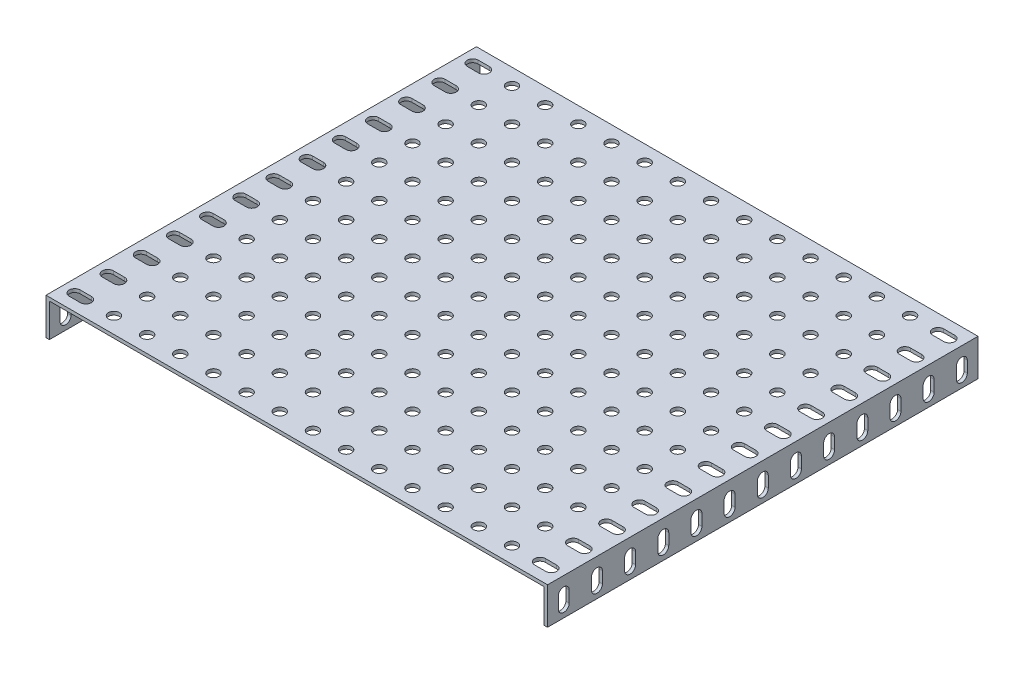
from build123d import *

# Parameters (mm, degrees)
SKETCH1_W           = 192.94
SKETCH1_H           = 165.58
SKETCH1_R           = 2.11
BOSS_EXTRUDE1_DEPTH = 1.3
SKETCH3_W           = 165.58
SKETCH3_H           = 14.16
BOSS_EXTRUDE2_DEPTH = 1.3


with BuildPart() as part:
    # Sketch1 → Boss-Extrude1 (new body)
    with BuildSketch(Plane(origin=(0, 0, 0), x_dir=(1, 0, 0), z_dir=(0, 1, 0))):
        Rectangle(SKETCH1_W, SKETCH1_H)
        with Locations(Location((-76.56, -76.56, 0), (0, 0, 270))):
            Circle(SKETCH1_R, mode=Mode.SUBTRACT)
        with Locations(Location((-63.8, -76.56, 0), (0, 0, 270))):
            Circle(SKETCH1_R, mode=Mode.SUBTRACT)
        with Locations(Location((-51.04, -76.56, 0), (0, 0, 270))):
            Circle(SKETCH1_R, mode=Mode.SUBTRACT)
        with Locations(Location((-38.28, -76.56, 0), (0, 0, 270))):
            Circle(SKETCH1_R, mode=Mode.SUBTRACT)
        with Locations(Location((-25.52, -76.56, 0), (0, 0, 270))):
            Circle(SKETCH1_R, mode=Mode.SUBTRACT)
        with Locations(Location((-12.76, -76.56, 0), (0, 0, 270))):
            Circle(SKETCH1_R, mode=Mode.SUBTRACT)
        with Locations(Location((0, -76.56, 0), (0, 0, 270))):
            Circle(SKETCH1_R, mode=Mode.SUBTRACT)
        with Locations(Location((12.76, -76.56, 0), (0, 0, 270))):
            Circle(SKETCH1_R, mode=Mode.SUBTRACT)
        with Locations(Location((25.52, -76.56, 0), (0, 0, 270))):
            Circle(SKETCH1_R, mode=Mode.SUBTRACT)
        with Locations(Location((38.28, -76.56, 0), (0, 0, 270))):
            Circle(SKETCH1_R, mode=Mode.SUBTRACT)
        with Locations(Location((51.04, -76.56, 0), (0, 0, 270))):
            Circle(SKETCH1_R, mode=Mode.SUBTRACT)
        with Locations(Location((63.8, -76.56, 0), (0, 0, 270))):
            Circle(SKETCH1_R, mode=Mode.SUBTRACT)
        with Locations(Location((76.56, -76.56, 0), (0, 0, 270))):
            Circle(SKETCH1_R, mode=Mode.SUBTRACT)
        with Locations(Location((-63.8, -63.8, 0), (0, 0, 270))):
            Circle(SKETCH1_R, mode=Mode.SUBTRACT)
        with Locations(Location((-51.04, -63.8, 0), (0, 0, 270))):
            Circle(SKETCH1_R, mode=Mode.SUBTRACT)
        with Locations(Location((-38.28, -63.8, 0), (0, 0, 270))):
            Circle(SKETCH1_R, mode=Mode.SUBTRACT)
        with Locations(Location((-25.52, -63.8, 0), (0, 0, 270))):
            Circle(SKETCH1_R, mode=Mode.SUBTRACT)
        with Locations(Location((-12.76, -63.8, 0), (0, 0, 270))):
            Circle(SKETCH1_R, mode=Mode.SUBTRACT)
        with Locations(Location((0, -63.8, 0), (0, 0, 270))):
            Circle(SKETCH1_R, mode=Mode.SUBTRACT)
        with Locations(Location((12.76, -63.8, 0), (0, 0, 270))):
            Circle(SKETCH1_R, mode=Mode.SUBTRACT)
        with Locations(Location((25.52, -63.8, 0), (0, 0, 270))):
            Circle(SKETCH1_R, mode=Mode.SUBTRACT)
        with Locations(Location((38.28, -63.8, 0), (0, 0, 270))):
            Circle(SKETCH1_R, mode=Mode.SUBTRACT)
        with Locations(Location((51.04, -63.8, 0), (0, 0, 270))):
            Circle(SKETCH1_R, mode=Mode.SUBTRACT)
        with Locations(Location((63.8, -63.8, 0), (0, 0, 270))):
            Circle(SKETCH1_R, mode=Mode.SUBTRACT)
        with Locations(Location((76.56, -63.8, 0), (0, 0, 270))):
            Circle(SKETCH1_R, mode=Mode.SUBTRACT)
        with Locations(Location((-63.8, -51.04, 0), (0, 0, 270))):
            Circle(SKETCH1_R, mode=Mode.SUBTRACT)
        with Locations(Location((-51.04, -51.04, 0), (0, 0, 270))):
            Circle(SKETCH1_R, mode=Mode.SUBTRACT)
        with Locations(Location((-38.28, -51.04, 0), (0, 0, 270))):
            Circle(SKETCH1_R, mode=Mode.SUBTRACT)
        with Locations(Location((-25.52, -51.04, 0), (0, 0, 270))):
            Circle(SKETCH1_R, mode=Mode.SUBTRACT)
        with Locations(Location((-12.76, -51.04, 0), (0, 0, 270))):
            Circle(SKETCH1_R, mode=Mode.SUBTRACT)
        with Locations(Location((0, -51.04, 0), (0, 0, 270))):
            Circle(SKETCH1_R, mode=Mode.SUBTRACT)
        with Locations(Location((12.76, -51.04, 0), (0, 0, 270))):
            Circle(SKETCH1_R, mode=Mode.SUBTRACT)
        with Locations(Location((25.52, -51.04, 0), (0, 0, 270))):
            Circle(SKETCH1_R, mode=Mode.SUBTRACT)
        with Locations(Location((38.28, -51.04, 0), (0, 0, 270))):
            Circle(SKETCH1_R, mode=Mode.SUBTRACT)
        with Locations(Location((51.04, -51.04, 0), (0, 0, 270))):
            Circle(SKETCH1_R, mode=Mode.SUBTRACT)
        with Locations(Location((63.8, -51.04, 0), (0, 0, 270))):
            Circle(SKETCH1_R, mode=Mode.SUBTRACT)
        with Locations(Location((76.56, -51.04, 0), (0, 0, 270))):
            Circle(SKETCH1_R, mode=Mode.SUBTRACT)
        with Locations(Location((-63.8, -38.28, 0), (0, 0, 270))):
            Circle(SKETCH1_R, mode=Mode.SUBTRACT)
        with Locations(Location((-51.04, -38.28, 0), (0, 0, 270))):
            Circle(SKETCH1_R, mode=Mode.SUBTRACT)
        with Locations(Location((-38.28, -38.28, 0), (0, 0, 270))):
            Circle(SKETCH1_R, mode=Mode.SUBTRACT)
        with Locations(Location((-25.52, -38.28, 0), (0, 0, 270))):
            Circle(SKETCH1_R, mode=Mode.SUBTRACT)
        with Locations(Location((-12.76, -38.28, 0), (0, 0, 270))):
            Circle(SKETCH1_R, mode=Mode.SUBTRACT)
        with Locations(Location((0, -38.28, 0), (0, 0, 270))):
            Circle(SKETCH1_R, mode=Mode.SUBTRACT)
        with Locations(Location((12.76, -38.28, 0), (0, 0, 270))):
            Circle(SKETCH1_R, mode=Mode.SUBTRACT)
        with Locations(Location((25.52, -38.28, 0), (0, 0, 270))):
            Circle(SKETCH1_R, mode=Mode.SUBTRACT)
        with Locations(Location((38.28, -38.28, 0), (0, 0, 270))):
            Circle(SKETCH1_R, mode=Mode.SUBTRACT)
        with Locations(Location((51.04, -38.28, 0), (0, 0, 270))):
            Circle(SKETCH1_R, mode=Mode.SUBTRACT)
        with Locations(Location((63.8, -38.28, 0), (0, 0, 270))):
            Circle(SKETCH1_R, mode=Mode.SUBTRACT)
        with Locations(Location((76.56, -38.28, 0), (0, 0, 270))):
            Circle(SKETCH1_R, mode=Mode.SUBTRACT)
        with Locations(Location((-63.8, -25.52, 0), (0, 0, 270))):
            Circle(SKETCH1_R, mode=Mode.SUBTRACT)
        with Locations(Location((-51.04, -25.52, 0), (0, 0, 270))):
            Circle(SKETCH1_R, mode=Mode.SUBTRACT)
        with Locations(Location((-38.28, -25.52, 0), (0, 0, 270))):
            Circle(SKETCH1_R, mode=Mode.SUBTRACT)
        with Locations(Location((-25.52, -25.52, 0), (0, 0, 270))):
            Circle(SKETCH1_R, mode=Mode.SUBTRACT)
        with Locations(Location((-12.76, -25.52, 0), (0, 0, 270))):
            Circle(SKETCH1_R, mode=Mode.SUBTRACT)
        with Locations(Location((0, -25.52, 0), (0, 0, 270))):
            Circle(SKETCH1_R, mode=Mode.SUBTRACT)
        with Locations(Location((12.76, -25.52, 0), (0, 0, 270))):
            Circle(SKETCH1_R, mode=Mode.SUBTRACT)
        with Locations(Location((25.52, -25.52, 0), (0, 0, 270))):
            Circle(SKETCH1_R, mode=Mode.SUBTRACT)
        with Locations(Location((38.28, -25.52, 0), (0, 0, 270))):
            Circle(SKETCH1_R, mode=Mode.SUBTRACT)
        with Locations(Location((51.04, -25.52, 0), (0, 0, 270))):
            Circle(SKETCH1_R, mode=Mode.SUBTRACT)
        with Locations(Location((63.8, -25.52, 0), (0, 0, 270))):
            Circle(SKETCH1_R, mode=Mode.SUBTRACT)
        with Locations(Location((76.56, -25.52, 0), (0, 0, 270))):
            Circle(SKETCH1_R, mode=Mode.SUBTRACT)
        with Locations(Location((-63.8, -12.76, 0), (0, 0, 270))):
            Circle(SKETCH1_R, mode=Mode.SUBTRACT)
        with Locations(Location((-51.04, -12.76, 0), (0, 0, 270))):
            Circle(SKETCH1_R, mode=Mode.SUBTRACT)
        with Locations(Location((-38.28, -12.76, 0), (0, 0, 270))):
            Circle(SKETCH1_R, mode=Mode.SUBTRACT)
        with Locations(Location((-25.52, -12.76, 0), (0, 0, 270))):
            Circle(SKETCH1_R, mode=Mode.SUBTRACT)
        with Locations(Location((-12.76, -12.76, 0), (0, 0, 270))):
            Circle(SKETCH1_R, mode=Mode.SUBTRACT)
        with Locations(Location((0, -12.76, 0), (0, 0, 270))):
            Circle(SKETCH1_R, mode=Mode.SUBTRACT)
        with Locations(Location((12.76, -12.76, 0), (0, 0, 270))):
            Circle(SKETCH1_R, mode=Mode.SUBTRACT)
        with Locations(Location((25.52, -12.76, 0), (0, 0, 270))):
            Circle(SKETCH1_R, mode=Mode.SUBTRACT)
        with Locations(Location((38.28, -12.76, 0), (0, 0, 270))):
            Circle(SKETCH1_R, mode=Mode.SUBTRACT)
        with Locations(Location((51.04, -12.76, 0), (0, 0, 270))):
            Circle(SKETCH1_R, mode=Mode.SUBTRACT)
        with Locations(Location((63.8, -12.76, 0), (0, 0, 270))):
            Circle(SKETCH1_R, mode=Mode.SUBTRACT)
        with Locations(Location((76.56, -12.76, 0), (0, 0, 270))):
            Circle(SKETCH1_R, mode=Mode.SUBTRACT)
        with Locations(Location((-63.8, 0, 0), (0, 0, 270))):
            Circle(SKETCH1_R, mode=Mode.SUBTRACT)
        with Locations(Location((-51.04, 0, 0), (0, 0, 270))):
            Circle(SKETCH1_R, mode=Mode.SUBTRACT)
        with Locations(Location((-38.28, 0, 0), (0, 0, 270))):
            Circle(SKETCH1_R, mode=Mode.SUBTRACT)
        with Locations(Location((-25.52, 0, 0), (0, 0, 270))):
            Circle(SKETCH1_R, mode=Mode.SUBTRACT)
        with Locations(Location((-12.76, 0, 0), (0, 0, 270))):
            Circle(SKETCH1_R, mode=Mode.SUBTRACT)
        with Locations(Location((0, 0, 0), (0, 0, 270))):
            Circle(SKETCH1_R, mode=Mode.SUBTRACT)
        with Locations(Location((12.76, 0, 0), (0, 0, 270))):
            Circle(SKETCH1_R, mode=Mode.SUBTRACT)
        with Locations(Location((25.52, 0, 0), (0, 0, 270))):
            Circle(SKETCH1_R, mode=Mode.SUBTRACT)
        with Locations(Location((38.28, 0, 0), (0, 0, 270))):
            Circle(SKETCH1_R, mode=Mode.SUBTRACT)
        with Locations(Location((51.04, 0, 0), (0, 0, 270))):
            Circle(SKETCH1_R, mode=Mode.SUBTRACT)
        with Locations(Location((63.8, 0, 0), (0, 0, 270))):
            Circle(SKETCH1_R, mode=Mode.SUBTRACT)
        with Locations(Location((76.56, 0, 0), (0, 0, 270))):
            Circle(SKETCH1_R, mode=Mode.SUBTRACT)
        with Locations(Location((-63.8, 12.76, 0), (0, 0, 270))):
            Circle(SKETCH1_R, mode=Mode.SUBTRACT)
        with Locations(Location((-51.04, 12.76, 0), (0, 0, 270))):
            Circle(SKETCH1_R, mode=Mode.SUBTRACT)
        with Locations(Location((-38.28, 12.76, 0), (0, 0, 270))):
            Circle(SKETCH1_R, mode=Mode.SUBTRACT)
        with Locations(Location((-25.52, 12.76, 0), (0, 0, 270))):
            Circle(SKETCH1_R, mode=Mode.SUBTRACT)
        with Locations(Location((-12.76, 12.76, 0), (0, 0, 270))):
            Circle(SKETCH1_R, mode=Mode.SUBTRACT)
        with Locations(Location((0, 12.76, 0), (0, 0, 270))):
            Circle(SKETCH1_R, mode=Mode.SUBTRACT)
        with Locations(Location((12.76, 12.76, 0), (0, 0, 270))):
            Circle(SKETCH1_R, mode=Mode.SUBTRACT)
        with Locations(Location((25.52, 12.76, 0), (0, 0, 270))):
            Circle(SKETCH1_R, mode=Mode.SUBTRACT)
        with Locations(Location((38.28, 12.76, 0), (0, 0, 270))):
            Circle(SKETCH1_R, mode=Mode.SUBTRACT)
        with Locations(Location((51.04, 12.76, 0), (0, 0, 270))):
            Circle(SKETCH1_R, mode=Mode.SUBTRACT)
        with Locations(Location((63.8, 12.76, 0), (0, 0, 270))):
            Circle(SKETCH1_R, mode=Mode.SUBTRACT)
        with Locations(Location((76.56, 12.76, 0), (0, 0, 270))):
            Circle(SKETCH1_R, mode=Mode.SUBTRACT)
        with Locations(Location((-63.8, 25.52, 0), (0, 0, 270))):
            Circle(SKETCH1_R, mode=Mode.SUBTRACT)
        with Locations(Location((-51.04, 25.52, 0), (0, 0, 270))):
            Circle(SKETCH1_R, mode=Mode.SUBTRACT)
        with Locations(Location((-38.28, 25.52, 0), (0, 0, 270))):
            Circle(SKETCH1_R, mode=Mode.SUBTRACT)
        with Locations(Location((-25.52, 25.52, 0), (0, 0, 270))):
            Circle(SKETCH1_R, mode=Mode.SUBTRACT)
        with Locations(Location((-12.76, 25.52, 0), (0, 0, 270))):
            Circle(SKETCH1_R, mode=Mode.SUBTRACT)
        with Locations(Location((0, 25.52, 0), (0, 0, 270))):
            Circle(SKETCH1_R, mode=Mode.SUBTRACT)
        with Locations(Location((12.76, 25.52, 0), (0, 0, 270))):
            Circle(SKETCH1_R, mode=Mode.SUBTRACT)
        with Locations(Location((25.52, 25.52, 0), (0, 0, 270))):
            Circle(SKETCH1_R, mode=Mode.SUBTRACT)
        with Locations(Location((38.28, 25.52, 0), (0, 0, 270))):
            Circle(SKETCH1_R, mode=Mode.SUBTRACT)
        with Locations(Location((51.04, 25.52, 0), (0, 0, 270))):
            Circle(SKETCH1_R, mode=Mode.SUBTRACT)
        with Locations(Location((63.8, 25.52, 0), (0, 0, 270))):
            Circle(SKETCH1_R, mode=Mode.SUBTRACT)
        with Locations(Location((76.56, 25.52, 0), (0, 0, 270))):
            Circle(SKETCH1_R, mode=Mode.SUBTRACT)
        with Locations(Location((-63.8, 38.28, 0), (0, 0, 270))):
            Circle(SKETCH1_R, mode=Mode.SUBTRACT)
        with Locations(Location((-51.04, 38.28, 0), (0, 0, 270))):
            Circle(SKETCH1_R, mode=Mode.SUBTRACT)
        with Locations(Location((-38.28, 38.28, 0), (0, 0, 270))):
            Circle(SKETCH1_R, mode=Mode.SUBTRACT)
        with Locations(Location((-25.52, 38.28, 0), (0, 0, 270))):
            Circle(SKETCH1_R, mode=Mode.SUBTRACT)
        with Locations(Location((-12.76, 38.28, 0), (0, 0, 270))):
            Circle(SKETCH1_R, mode=Mode.SUBTRACT)
        with Locations(Location((0, 38.28, 0), (0, 0, 270))):
            Circle(SKETCH1_R, mode=Mode.SUBTRACT)
        with Locations(Location((12.76, 38.28, 0), (0, 0, 270))):
            Circle(SKETCH1_R, mode=Mode.SUBTRACT)
        with Locations(Location((25.52, 38.28, 0), (0, 0, 270))):
            Circle(SKETCH1_R, mode=Mode.SUBTRACT)
        with Locations(Location((38.28, 38.28, 0), (0, 0, 270))):
            Circle(SKETCH1_R, mode=Mode.SUBTRACT)
        with Locations(Location((51.04, 38.28, 0), (0, 0, 270))):
            Circle(SKETCH1_R, mode=Mode.SUBTRACT)
        with Locations(Location((63.8, 38.28, 0), (0, 0, 270))):
            Circle(SKETCH1_R, mode=Mode.SUBTRACT)
        with Locations(Location((76.56, 38.28, 0), (0, 0, 270))):
            Circle(SKETCH1_R, mode=Mode.SUBTRACT)
        with Locations(Location((-63.8, 51.04, 0), (0, 0, 270))):
            Circle(SKETCH1_R, mode=Mode.SUBTRACT)
        with Locations(Location((-51.04, 51.04, 0), (0, 0, 270))):
            Circle(SKETCH1_R, mode=Mode.SUBTRACT)
        with Locations(Location((-38.28, 51.04, 0), (0, 0, 270))):
            Circle(SKETCH1_R, mode=Mode.SUBTRACT)
        with Locations(Location((-25.52, 51.04, 0), (0, 0, 270))):
            Circle(SKETCH1_R, mode=Mode.SUBTRACT)
        with Locations(Location((-12.76, 51.04, 0), (0, 0, 270))):
            Circle(SKETCH1_R, mode=Mode.SUBTRACT)
        with Locations(Location((0, 51.04, 0), (0, 0, 270))):
            Circle(SKETCH1_R, mode=Mode.SUBTRACT)
        with Locations(Location((12.76, 51.04, 0), (0, 0, 270))):
            Circle(SKETCH1_R, mode=Mode.SUBTRACT)
        with Locations(Location((25.52, 51.04, 0), (0, 0, 270))):
            Circle(SKETCH1_R, mode=Mode.SUBTRACT)
        with Locations(Location((38.28, 51.04, 0), (0, 0, 270))):
            Circle(SKETCH1_R, mode=Mode.SUBTRACT)
        with Locations(Location((51.04, 51.04, 0), (0, 0, 270))):
            Circle(SKETCH1_R, mode=Mode.SUBTRACT)
        with Locations(Location((63.8, 51.04, 0), (0, 0, 270))):
            Circle(SKETCH1_R, mode=Mode.SUBTRACT)
        with Locations(Location((76.56, 51.04, 0), (0, 0, 270))):
            Circle(SKETCH1_R, mode=Mode.SUBTRACT)
        with Locations(Location((-63.8, 63.8, 0), (0, 0, 270))):
            Circle(SKETCH1_R, mode=Mode.SUBTRACT)
        with Locations(Location((-51.04, 63.8, 0), (0, 0, 270))):
            Circle(SKETCH1_R, mode=Mode.SUBTRACT)
        with Locations(Location((-38.28, 63.8, 0), (0, 0, 270))):
            Circle(SKETCH1_R, mode=Mode.SUBTRACT)
        with Locations(Location((-25.52, 63.8, 0), (0, 0, 270))):
            Circle(SKETCH1_R, mode=Mode.SUBTRACT)
        with Locations(Location((-12.76, 63.8, 0), (0, 0, 270))):
            Circle(SKETCH1_R, mode=Mode.SUBTRACT)
        with Locations(Location((0, 63.8, 0), (0, 0, 270))):
            Circle(SKETCH1_R, mode=Mode.SUBTRACT)
        with Locations(Location((12.76, 63.8, 0), (0, 0, 270))):
            Circle(SKETCH1_R, mode=Mode.SUBTRACT)
        with Locations(Location((25.52, 63.8, 0), (0, 0, 270))):
            Circle(SKETCH1_R, mode=Mode.SUBTRACT)
        with Locations(Location((38.28, 63.8, 0), (0, 0, 270))):
            Circle(SKETCH1_R, mode=Mode.SUBTRACT)
        with Locations(Location((51.04, 63.8, 0), (0, 0, 270))):
            Circle(SKETCH1_R, mode=Mode.SUBTRACT)
        with Locations(Location((63.8, 63.8, 0), (0, 0, 270))):
            Circle(SKETCH1_R, mode=Mode.SUBTRACT)
        with Locations(Location((76.56, 63.8, 0), (0, 0, 270))):
            Circle(SKETCH1_R, mode=Mode.SUBTRACT)
        with Locations(Location((-63.8, 76.56, 0), (0, 0, 270))):
            Circle(SKETCH1_R, mode=Mode.SUBTRACT)
        with Locations(Location((-51.04, 76.56, 0), (0, 0, 270))):
            Circle(SKETCH1_R, mode=Mode.SUBTRACT)
        with Locations(Location((-38.28, 76.56, 0), (0, 0, 270))):
            Circle(SKETCH1_R, mode=Mode.SUBTRACT)
        with Locations(Location((-25.52, 76.56, 0), (0, 0, 270))):
            Circle(SKETCH1_R, mode=Mode.SUBTRACT)
        with Locations(Location((-12.76, 76.56, 0), (0, 0, 270))):
            Circle(SKETCH1_R, mode=Mode.SUBTRACT)
        with Locations(Location((0, 76.56, 0), (0, 0, 270))):
            Circle(SKETCH1_R, mode=Mode.SUBTRACT)
        with Locations(Location((12.76, 76.56, 0), (0, 0, 270))):
            Circle(SKETCH1_R, mode=Mode.SUBTRACT)
        with Locations(Location((25.52, 76.56, 0), (0, 0, 270))):
            Circle(SKETCH1_R, mode=Mode.SUBTRACT)
        with Locations(Location((38.28, 76.56, 0), (0, 0, 270))):
            Circle(SKETCH1_R, mode=Mode.SUBTRACT)
        with Locations(Location((51.04, 76.56, 0), (0, 0, 270))):
            Circle(SKETCH1_R, mode=Mode.SUBTRACT)
        with Locations(Location((63.8, 76.56, 0), (0, 0, 270))):
            Circle(SKETCH1_R, mode=Mode.SUBTRACT)
        with Locations(Location((76.56, 76.56, 0), (0, 0, 270))):
            Circle(SKETCH1_R, mode=Mode.SUBTRACT)
        with Locations(Location((-76.56, -63.8, 0), (0, 0, 270))):
            Circle(SKETCH1_R, mode=Mode.SUBTRACT)
        with Locations(Location((-76.56, -51.04, 0), (0, 0, 270))):
            Circle(SKETCH1_R, mode=Mode.SUBTRACT)
        with Locations(Location((-76.56, -38.28, 0), (0, 0, 270))):
            Circle(SKETCH1_R, mode=Mode.SUBTRACT)
        with Locations(Location((-76.56, -25.52, 0), (0, 0, 270))):
            Circle(SKETCH1_R, mode=Mode.SUBTRACT)
        with Locations(Location((-76.56, -12.76, 0), (0, 0, 270))):
            Circle(SKETCH1_R, mode=Mode.SUBTRACT)
        with Locations(Location((-76.56, 0, 0), (0, 0, 270))):
            Circle(SKETCH1_R, mode=Mode.SUBTRACT)
        with Locations(Location((-76.56, 12.76, 0), (0, 0, 270))):
            Circle(SKETCH1_R, mode=Mode.SUBTRACT)
        with Locations(Location((-76.56, 25.52, 0), (0, 0, 270))):
            Circle(SKETCH1_R, mode=Mode.SUBTRACT)
        with Locations(Location((-76.56, 38.28, 0), (0, 0, 270))):
            Circle(SKETCH1_R, mode=Mode.SUBTRACT)
        with Locations(Location((-76.56, 51.04, 0), (0, 0, 270))):
            Circle(SKETCH1_R, mode=Mode.SUBTRACT)
        with Locations(Location((-76.56, 63.8, 0), (0, 0, 270))):
            Circle(SKETCH1_R, mode=Mode.SUBTRACT)
        with Locations(Location((-76.56, 76.56, 0), (0, 0, 270))):
            Circle(SKETCH1_R, mode=Mode.SUBTRACT)
        with BuildLine():
            Line((-91.66, 78.67), (-87.36, 78.67))
            ThreePointArc((-87.36, 78.67), (-85.25, 76.56), (-87.36, 74.45))
            Line((-87.36, 74.45), (-91.66, 74.45))
            ThreePointArc((-91.66, 74.45), (-93.77, 76.56), (-91.66, 78.67))
        make_face(mode=Mode.SUBTRACT)
        with BuildLine():
            Line((-91.66, 65.91), (-87.36, 65.91))
            ThreePointArc((-87.36, 65.91), (-85.25, 63.8), (-87.36, 61.69))
            Line((-87.36, 61.69), (-91.66, 61.69))
            ThreePointArc((-91.66, 61.69), (-93.77, 63.8), (-91.66, 65.91))
        make_face(mode=Mode.SUBTRACT)
        with BuildLine():
            Line((-91.66, 53.15), (-87.36, 53.15))
            ThreePointArc((-87.36, 53.15), (-85.25, 51.04), (-87.36, 48.93))
            Line((-87.36, 48.93), (-91.66, 48.93))
            ThreePointArc((-91.66, 48.93), (-93.77, 51.04), (-91.66, 53.15))
        make_face(mode=Mode.SUBTRACT)
        with BuildLine():
            Line((-91.66, 40.39), (-87.36, 40.39))
            ThreePointArc((-87.36, 40.39), (-85.25, 38.28), (-87.36, 36.17))
            Line((-87.36, 36.17), (-91.66, 36.17))
            ThreePointArc((-91.66, 36.17), (-93.77, 38.28), (-91.66, 40.39))
        make_face(mode=Mode.SUBTRACT)
        with BuildLine():
            Line((-91.66, 27.63), (-87.36, 27.63))
            ThreePointArc((-87.36, 27.63), (-85.25, 25.52), (-87.36, 23.41))
            Line((-87.36, 23.41), (-91.66, 23.41))
            ThreePointArc((-91.66, 23.41), (-93.77, 25.52), (-91.66, 27.63))
        make_face(mode=Mode.SUBTRACT)
        with BuildLine():
            Line((-91.66, 14.87), (-87.36, 14.87))
            ThreePointArc((-87.36, 14.87), (-85.25, 12.76), (-87.36, 10.65))
            Line((-87.36, 10.65), (-91.66, 10.65))
            ThreePointArc((-91.66, 10.65), (-93.77, 12.76), (-91.66, 14.87))
        make_face(mode=Mode.SUBTRACT)
        with BuildLine():
            Line((-91.66, 2.11), (-87.36, 2.11))
            ThreePointArc((-87.36, 2.11), (-85.25, 0), (-87.36, -2.11))
            Line((-87.36, -2.11), (-91.66, -2.11))
            ThreePointArc((-91.66, -2.11), (-93.77, 0), (-91.66, 2.11))
        make_face(mode=Mode.SUBTRACT)
        with BuildLine():
            Line((-91.66, -10.65), (-87.36, -10.65))
            ThreePointArc((-87.36, -10.65), (-85.25, -12.76), (-87.36, -14.87))
            Line((-87.36, -14.87), (-91.66, -14.87))
            ThreePointArc((-91.66, -14.87), (-93.77, -12.76), (-91.66, -10.65))
        make_face(mode=Mode.SUBTRACT)
        with BuildLine():
            Line((-91.66, -23.41), (-87.36, -23.41))
            ThreePointArc((-87.36, -23.41), (-85.25, -25.52), (-87.36, -27.63))
            Line((-87.36, -27.63), (-91.66, -27.63))
            ThreePointArc((-91.66, -27.63), (-93.77, -25.52), (-91.66, -23.41))
        make_face(mode=Mode.SUBTRACT)
        with BuildLine():
            Line((-91.66, -36.17), (-87.36, -36.17))
            ThreePointArc((-87.36, -36.17), (-85.25, -38.28), (-87.36, -40.39))
            Line((-87.36, -40.39), (-91.66, -40.39))
            ThreePointArc((-91.66, -40.39), (-93.77, -38.28), (-91.66, -36.17))
        make_face(mode=Mode.SUBTRACT)
        with BuildLine():
            Line((-91.66, -48.93), (-87.36, -48.93))
            ThreePointArc((-87.36, -48.93), (-85.25, -51.04), (-87.36, -53.15))
            Line((-87.36, -53.15), (-91.66, -53.15))
            ThreePointArc((-91.66, -53.15), (-93.77, -51.04), (-91.66, -48.93))
        make_face(mode=Mode.SUBTRACT)
        with BuildLine():
            Line((-91.66, -61.69), (-87.36, -61.69))
            ThreePointArc((-87.36, -61.69), (-85.25, -63.8), (-87.36, -65.91))
            Line((-87.36, -65.91), (-91.66, -65.91))
            ThreePointArc((-91.66, -65.91), (-93.77, -63.8), (-91.66, -61.69))
        make_face(mode=Mode.SUBTRACT)
        with BuildLine():
            Line((-91.66, -74.45), (-87.36, -74.45))
            ThreePointArc((-87.36, -74.45), (-85.25, -76.56), (-87.36, -78.67))
            Line((-87.36, -78.67), (-91.66, -78.67))
            ThreePointArc((-91.66, -78.67), (-93.77, -76.56), (-91.66, -74.45))
        make_face(mode=Mode.SUBTRACT)
        with BuildLine():
            Line((91.66, 78.67), (87.36, 78.67))
            ThreePointArc((87.36, 78.67), (85.25, 76.56), (87.36, 74.45))
            Line((87.36, 74.45), (91.66, 74.45))
            ThreePointArc((91.66, 74.45), (93.77, 76.56), (91.66, 78.67))
        make_face(mode=Mode.SUBTRACT)
        with BuildLine():
            Line((91.66, 65.91), (87.36, 65.91))
            ThreePointArc((87.36, 65.91), (85.25, 63.8), (87.36, 61.69))
            Line((87.36, 61.69), (91.66, 61.69))
            ThreePointArc((91.66, 61.69), (93.77, 63.8), (91.66, 65.91))
        make_face(mode=Mode.SUBTRACT)
        with BuildLine():
            Line((91.66, 53.15), (87.36, 53.15))
            ThreePointArc((87.36, 53.15), (85.25, 51.04), (87.36, 48.93))
            Line((87.36, 48.93), (91.66, 48.93))
            ThreePointArc((91.66, 48.93), (93.77, 51.04), (91.66, 53.15))
        make_face(mode=Mode.SUBTRACT)
        with BuildLine():
            Line((91.66, 40.39), (87.36, 40.39))
            ThreePointArc((87.36, 40.39), (85.25, 38.28), (87.36, 36.17))
            Line((87.36, 36.17), (91.66, 36.17))
            ThreePointArc((91.66, 36.17), (93.77, 38.28), (91.66, 40.39))
        make_face(mode=Mode.SUBTRACT)
        with BuildLine():
            Line((91.66, 27.63), (87.36, 27.63))
            ThreePointArc((87.36, 27.63), (85.25, 25.52), (87.36, 23.41))
            Line((87.36, 23.41), (91.66, 23.41))
            ThreePointArc((91.66, 23.41), (93.77, 25.52), (91.66, 27.63))
        make_face(mode=Mode.SUBTRACT)
        with BuildLine():
            Line((91.66, 14.87), (87.36, 14.87))
            ThreePointArc((87.36, 14.87), (85.25, 12.76), (87.36, 10.65))
            Line((87.36, 10.65), (91.66, 10.65))
            ThreePointArc((91.66, 10.65), (93.77, 12.76), (91.66, 14.87))
        make_face(mode=Mode.SUBTRACT)
        with BuildLine():
            Line((91.66, 2.11), (87.36, 2.11))
            ThreePointArc((87.36, 2.11), (85.25, 0), (87.36, -2.11))
            Line((87.36, -2.11), (91.66, -2.11))
            ThreePointArc((91.66, -2.11), (93.77, 0), (91.66, 2.11))
        make_face(mode=Mode.SUBTRACT)
        with BuildLine():
            Line((91.66, -10.65), (87.36, -10.65))
            ThreePointArc((87.36, -10.65), (85.25, -12.76), (87.36, -14.87))
            Line((87.36, -14.87), (91.66, -14.87))
            ThreePointArc((91.66, -14.87), (93.77, -12.76), (91.66, -10.65))
        make_face(mode=Mode.SUBTRACT)
        with BuildLine():
            Line((91.66, -23.41), (87.36, -23.41))
            ThreePointArc((87.36, -23.41), (85.25, -25.52), (87.36, -27.63))
            Line((87.36, -27.63), (91.66, -27.63))
            ThreePointArc((91.66, -27.63), (93.77, -25.52), (91.66, -23.41))
        make_face(mode=Mode.SUBTRACT)
        with BuildLine():
            Line((91.66, -36.17), (87.36, -36.17))
            ThreePointArc((87.36, -36.17), (85.25, -38.28), (87.36, -40.39))
            Line((87.36, -40.39), (91.66, -40.39))
            ThreePointArc((91.66, -40.39), (93.77, -38.28), (91.66, -36.17))
        make_face(mode=Mode.SUBTRACT)
        with BuildLine():
            Line((91.66, -48.93), (87.36, -48.93))
            ThreePointArc((87.36, -48.93), (85.25, -51.04), (87.36, -53.15))
            Line((87.36, -53.15), (91.66, -53.15))
            ThreePointArc((91.66, -53.15), (93.77, -51.04), (91.66, -48.93))
        make_face(mode=Mode.SUBTRACT)
        with BuildLine():
            Line((91.66, -61.69), (87.36, -61.69))
            ThreePointArc((87.36, -61.69), (85.25, -63.8), (87.36, -65.91))
            Line((87.36, -65.91), (91.66, -65.91))
            ThreePointArc((91.66, -65.91), (93.77, -63.8), (91.66, -61.69))
        make_face(mode=Mode.SUBTRACT)
        with BuildLine():
            Line((91.66, -74.45), (87.36, -74.45))
            ThreePointArc((87.36, -74.45), (85.25, -76.56), (87.36, -78.67))
            Line((87.36, -78.67), (91.66, -78.67))
            ThreePointArc((91.66, -78.67), (93.77, -76.56), (91.66, -74.45))
        make_face(mode=Mode.SUBTRACT)
    extrude(amount=-BOSS_EXTRUDE1_DEPTH)

    # Sketch3 → Boss-Extrude2 (add)
    with BuildSketch(Plane.ZY.offset(96.47)):
        with Locations((0, -7.08)):
            Rectangle(SKETCH3_W, SKETCH3_H)
        with BuildLine():
            Line((-74.45, -5.91), (-74.45, -10.21))
            ThreePointArc((-74.45, -10.21), (-76.56, -12.32), (-78.67, -10.21))
            Line((-78.67, -10.21), (-78.67, -5.91))
            ThreePointArc((-78.67, -5.91), (-76.56, -3.8), (-74.45, -5.91))
        make_face(mode=Mode.SUBTRACT)
        with BuildLine():
            Line((-61.69, -5.91), (-61.69, -10.21))
            ThreePointArc((-61.69, -10.21), (-63.8, -12.32), (-65.91, -10.21))
            Line((-65.91, -10.21), (-65.91, -5.91))
            ThreePointArc((-65.91, -5.91), (-63.8, -3.8), (-61.69, -5.91))
        make_face(mode=Mode.SUBTRACT)
        with BuildLine():
            Line((-48.93, -5.91), (-48.93, -10.21))
            ThreePointArc((-48.93, -10.21), (-51.04, -12.32), (-53.15, -10.21))
            Line((-53.15, -10.21), (-53.15, -5.91))
            ThreePointArc((-53.15, -5.91), (-51.04, -3.8), (-48.93, -5.91))
        make_face(mode=Mode.SUBTRACT)
        with BuildLine():
            Line((-36.17, -5.91), (-36.17, -10.21))
            ThreePointArc((-36.17, -10.21), (-38.28, -12.32), (-40.39, -10.21))
            Line((-40.39, -10.21), (-40.39, -5.91))
            ThreePointArc((-40.39, -5.91), (-38.28, -3.8), (-36.17, -5.91))
        make_face(mode=Mode.SUBTRACT)
        with BuildLine():
            Line((-23.41, -5.91), (-23.41, -10.21))
            ThreePointArc((-23.41, -10.21), (-25.52, -12.32), (-27.63, -10.21))
            Line((-27.63, -10.21), (-27.63, -5.91))
            ThreePointArc((-27.63, -5.91), (-25.52, -3.8), (-23.41, -5.91))
        make_face(mode=Mode.SUBTRACT)
        with BuildLine():
            Line((-10.65, -5.91), (-10.65, -10.21))
            ThreePointArc((-10.65, -10.21), (-12.76, -12.32), (-14.87, -10.21))
            Line((-14.87, -10.21), (-14.87, -5.91))
            ThreePointArc((-14.87, -5.91), (-12.76, -3.8), (-10.65, -5.91))
        make_face(mode=Mode.SUBTRACT)
        with BuildLine():
            Line((2.11, -5.91), (2.11, -10.21))
            ThreePointArc((2.11, -10.21), (0, -12.32), (-2.11, -10.21))
            Line((-2.11, -10.21), (-2.11, -5.91))
            ThreePointArc((-2.11, -5.91), (0, -3.8), (2.11, -5.91))
        make_face(mode=Mode.SUBTRACT)
        with BuildLine():
            Line((14.87, -5.91), (14.87, -10.21))
            ThreePointArc((14.87, -10.21), (12.76, -12.32), (10.65, -10.21))
            Line((10.65, -10.21), (10.65, -5.91))
            ThreePointArc((10.65, -5.91), (12.76, -3.8), (14.87, -5.91))
        make_face(mode=Mode.SUBTRACT)
        with BuildLine():
            Line((27.63, -5.91), (27.63, -10.21))
            ThreePointArc((27.63, -10.21), (25.52, -12.32), (23.41, -10.21))
            Line((23.41, -10.21), (23.41, -5.91))
            ThreePointArc((23.41, -5.91), (25.52, -3.8), (27.63, -5.91))
        make_face(mode=Mode.SUBTRACT)
        with BuildLine():
            Line((40.39, -5.91), (40.39, -10.21))
            ThreePointArc((40.39, -10.21), (38.28, -12.32), (36.17, -10.21))
            Line((36.17, -10.21), (36.17, -5.91))
            ThreePointArc((36.17, -5.91), (38.28, -3.8), (40.39, -5.91))
        make_face(mode=Mode.SUBTRACT)
        with BuildLine():
            Line((53.15, -5.91), (53.15, -10.21))
            ThreePointArc((53.15, -10.21), (51.04, -12.32), (48.93, -10.21))
            Line((48.93, -10.21), (48.93, -5.91))
            ThreePointArc((48.93, -5.91), (51.04, -3.8), (53.15, -5.91))
        make_face(mode=Mode.SUBTRACT)
        with BuildLine():
            Line((65.91, -5.91), (65.91, -10.21))
            ThreePointArc((65.91, -10.21), (63.8, -12.32), (61.69, -10.21))
            Line((61.69, -10.21), (61.69, -5.91))
            ThreePointArc((61.69, -5.91), (63.8, -3.8), (65.91, -5.91))
        make_face(mode=Mode.SUBTRACT)
        with BuildLine():
            Line((78.67, -5.91), (78.67, -10.21))
            ThreePointArc((78.67, -10.21), (76.56, -12.32), (74.45, -10.21))
            Line((74.45, -10.21), (74.45, -5.91))
            ThreePointArc((74.45, -5.91), (76.56, -3.8), (78.67, -5.91))
        make_face(mode=Mode.SUBTRACT)
    boss_extrude2 = extrude(amount=-BOSS_EXTRUDE2_DEPTH)

    # Mirror1: Boss-Extrude2 across plane
    add(boss_extrude2.mirror(Plane(origin=(0, 0, 0), x_dir=(0, 0, 1), z_dir=(1, 0, 0))))


solid = part.part
